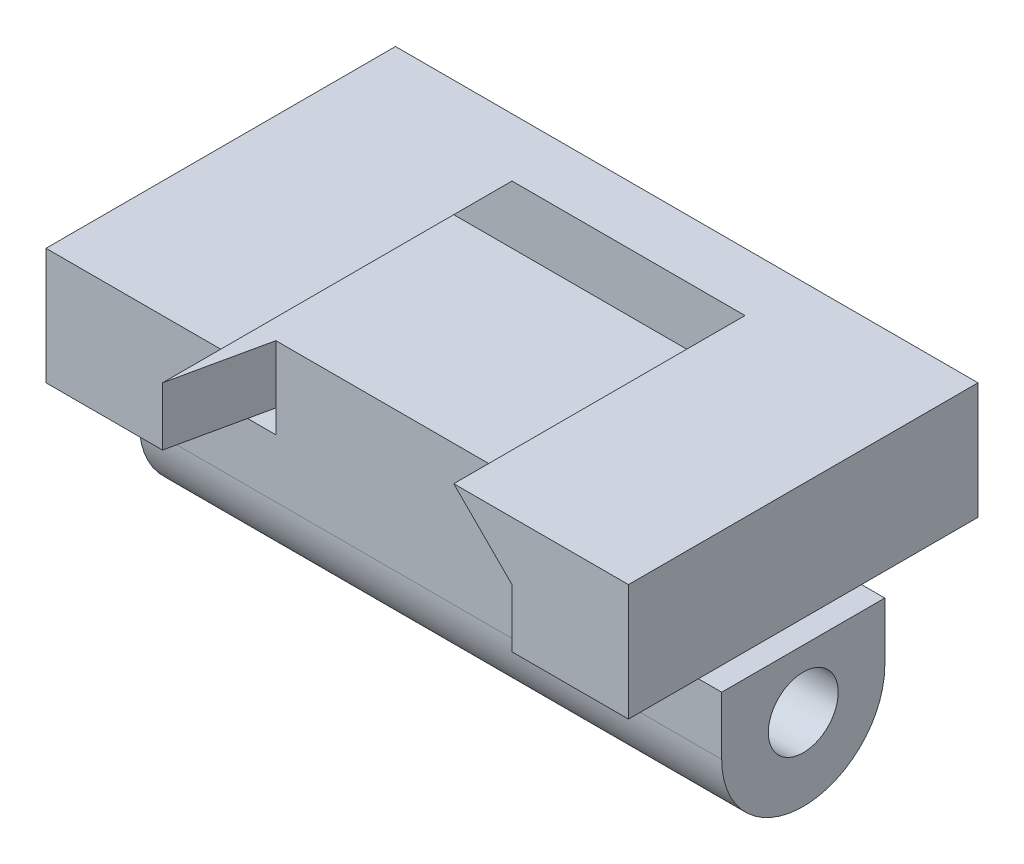
from build123d import *

# Parameters (mm, degrees)
BOSS_EXTRUDE1_DEPTH = 5
BOSS_EXTRUDE2_DEPTH = 2
BOSS_EXTRUDE7_DEPTH = 30
SKETCH11_R          = 3
BOSS_EXTRUDE8_DEPTH = 50
BOSS_EXTRUDE9_DEPTH = 5


with BuildPart() as part:
    # Sketch1 → Boss-Extrude1 (new body)
    with BuildSketch(Plane(origin=(0, 0, 0), x_dir=(1, 0, 0), z_dir=(0, 1, 0))):
        Polygon((-25, 15), (-25, -15), (-15, -15), (-13.266499161, -7), (13.266499161, -7), (15, -15), (25, -15), (25, 15), align=None)
    extrude(amount=BOSS_EXTRUDE1_DEPTH)

    # Sketch4 → Boss-Extrude2 (add)
    with BuildSketch(Plane.XZ):
        with BuildLine():
            Line((13.266499161, 7), (-13.266499161, 7))
            ThreePointArc((-13.266499161, 7), (-15, 0), (-13.266499161, -7))
            Line((-13.266499161, -7), (13.266499161, -7))
            ThreePointArc((13.266499161, -7), (14.560176637, -3.605725487), (15, 0))
            ThreePointArc((15, 0), (14.560176637, 3.605725487), (13.266499161, 7))
        make_face()
    extrude(amount=BOSS_EXTRUDE2_DEPTH)

    # Sketch10 → Boss-Extrude7 (add)
    with BuildSketch(Plane.XY.offset(15)):
        Polygon((-10, 10), (-25, 10), (-25, 5), (-15, 5), align=None)
        Polygon((10, 10), (15, 5), (25, 5), (25, 10), align=None)
    extrude(amount=-BOSS_EXTRUDE7_DEPTH)

    # Sketch11 → Boss-Extrude8 (add)
    with BuildSketch(Plane(origin=(25, 0, 0), x_dir=(0, 0, -1), z_dir=(1, 0, 0))):
        with BuildLine():
            Line((-7, -7), (-7, -2))
            Line((-7, -2), (7, -2))
            Line((7, -2), (7, -7))
            ThreePointArc((7, -7), (0, -14), (-7, -7))
        make_face()
        with Locations((0, -7)):
            Circle(SKETCH11_R, mode=Mode.SUBTRACT)
    extrude(amount=-BOSS_EXTRUDE8_DEPTH)

    # Sketch12 → Boss-Extrude9 (add)
    with BuildSketch(Plane(origin=(0, 0, -15), x_dir=(-1, 0, 0), z_dir=(0, 0, -1))):
        Polygon((-15, 5), (15, 5), (10, 10), (-10, 10), align=None)
    extrude(amount=-BOSS_EXTRUDE9_DEPTH)


solid = part.part
